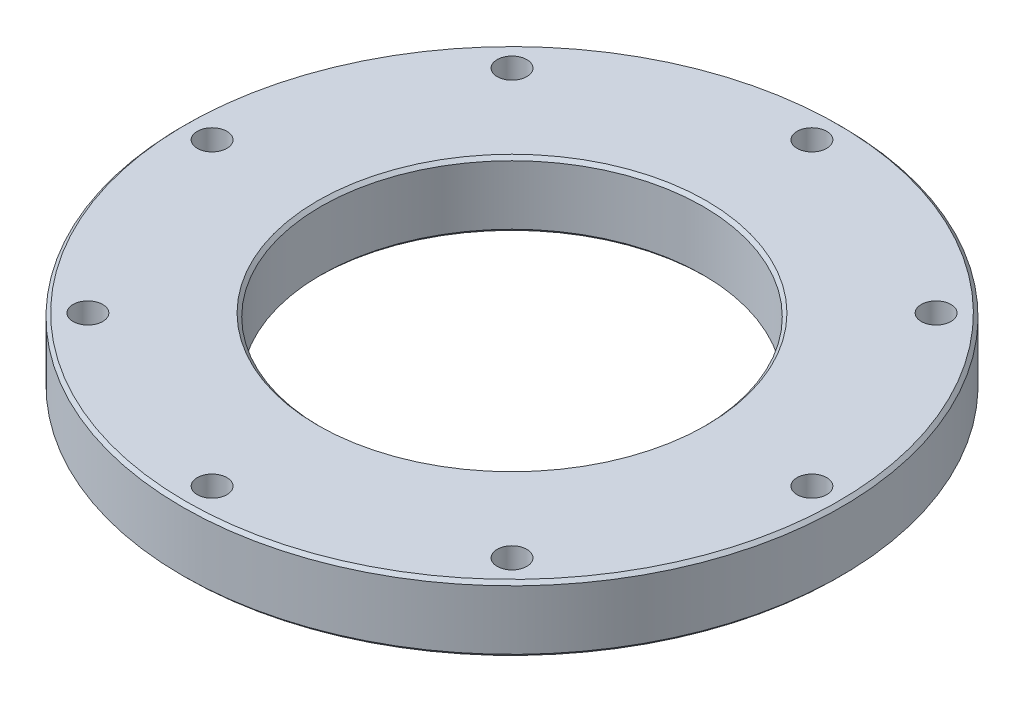
from build123d import *

# Parameters (mm, degrees)
SKETCH1_R           = 50
SKETCH1_R_2         = 2.25
SKETCH1_R_3         = 29
BOSS_EXTRUDE1_DEPTH = 10
CHAMFER1_SIZE       = 0.5


with BuildPart() as part:
    # Sketch1 → Boss-Extrude1 (new body)
    with BuildSketch(Plane(origin=(0, 0, 0), x_dir=(1, 0, 0), z_dir=(0, 1, 0))):
        Circle(SKETCH1_R)
        with Locations((0, 45.5)):
            Circle(SKETCH1_R_2, mode=Mode.SUBTRACT)
        with Locations((32.173358544, 32.173358544)):
            Circle(SKETCH1_R_2, mode=Mode.SUBTRACT)
        with Locations((45.5, 0)):
            Circle(SKETCH1_R_2, mode=Mode.SUBTRACT)
        with Locations((32.173358544, -32.173358544)):
            Circle(SKETCH1_R_2, mode=Mode.SUBTRACT)
        with Locations((0, -45.5)):
            Circle(SKETCH1_R_2, mode=Mode.SUBTRACT)
        with Locations((-32.173358544, -32.173358544)):
            Circle(SKETCH1_R_2, mode=Mode.SUBTRACT)
        with Locations((-45.5, 0)):
            Circle(SKETCH1_R_2, mode=Mode.SUBTRACT)
        with Locations((-32.173358544, 32.173358544)):
            Circle(SKETCH1_R_2, mode=Mode.SUBTRACT)
        Circle(SKETCH1_R_3, mode=Mode.SUBTRACT)
    extrude(amount=BOSS_EXTRUDE1_DEPTH)

    # Chamfer1
    chamfer1_edges = [part.edges().sort_by_distance(p)[0] for p in [
        (-29, 10, 0),
        (-29, 0, 0),
        (-50, 10, 0),
        (-50, 0, 0),
    ]]
    chamfer(chamfer1_edges, length=CHAMFER1_SIZE)


solid = part.part
